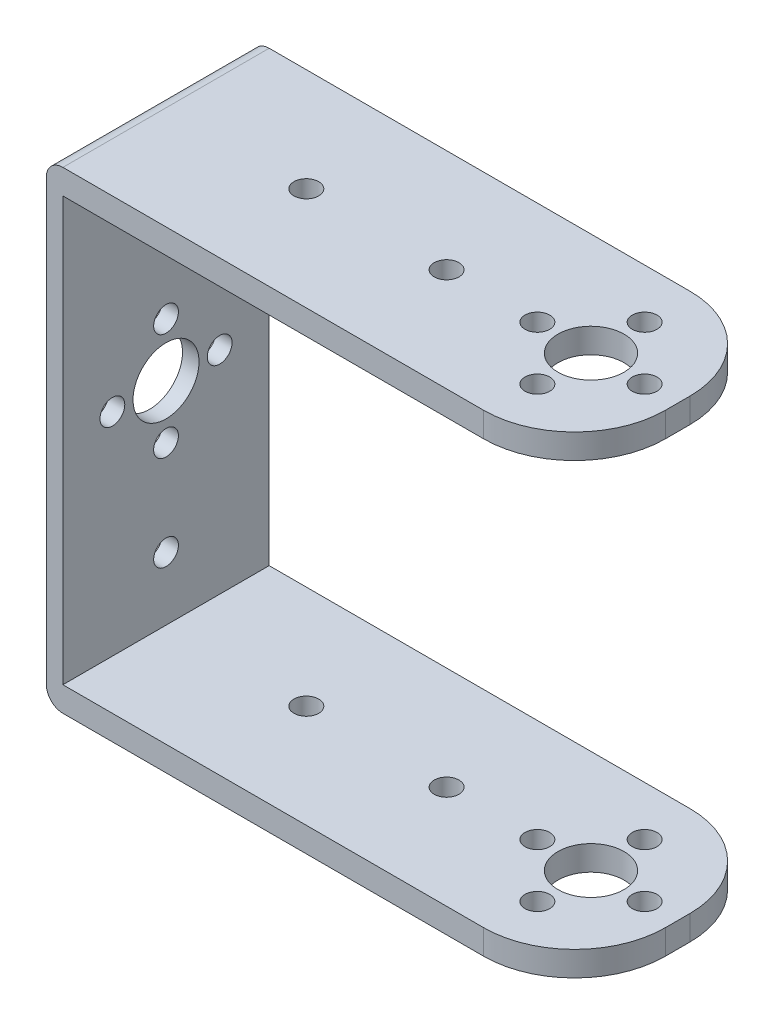
from build123d import *

# Parameters (mm, degrees)
BOSS_EXTRUDE1_DEPTH      = 56.3
BOSS_EXTRUDE1_DEPTH_BACK = 1
SKETCH1_W                = 64
SKETCH1_H                = 25
SKETCH3_W                = 62
SKETCH3_H                = 51.3
CUT_EXTRUDE2_DEPTH       = 89.829555892
SKETCH4_R                = 4
SKETCH4_R_2              = 1.5
CUT_EXTRUDE3_DEPTH       = 56
SKETCH8_R                = 1.5
CUT_EXTRUDE4_DEPTH       = 56
FILLET1_R                = 2
SKETCH9_R                = 1.5
SKETCH9_R_2              = 4
CUT_EXTRUDE5_DEPTH       = 90.466697715
FILLET3_R                = 11
SKETCH10_R               = 1.5
CUT_EXTRUDE6_DEPTH       = 90.466697715


with BuildPart() as part:
    # Sketch1 → Boss-Extrude1 (new, two sides: drawn at the far end of the back side and taken through both)
    with BuildSketch(Plane(origin=(0, 0, 0), x_dir=(1, 0, 0), z_dir=(0, 1, 0)).offset(-BOSS_EXTRUDE1_DEPTH_BACK)):
        with Locations((32, 12.5)):
            Rectangle(SKETCH1_W, SKETCH1_H)
    extrude(amount=BOSS_EXTRUDE1_DEPTH + BOSS_EXTRUDE1_DEPTH_BACK)

    # Sketch3 → Cut-Extrude2 (cut, through all)
    with BuildSketch(Plane.XY):
        with Locations((33, 27.65)):
            Rectangle(SKETCH3_W, SKETCH3_H)
    extrude(amount=-CUT_EXTRUDE2_DEPTH, mode=Mode.SUBTRACT)

    # Sketch4 → Cut-Extrude3 (cut)
    with BuildSketch(Plane(origin=(2, 0, 0), x_dir=(0, 0, -1), z_dir=(1, 0, 0))):
        with Locations(Location((12.5, 27.65, 0), (0, 0, 90))):
            Circle(SKETCH4_R)
        with Locations(Location((19, 27.65, 0), (0, 0, 90))):
            Circle(SKETCH4_R_2)
        with Locations(Location((12.5, 34.15, 0), (0, 0, 90))):
            Circle(SKETCH4_R_2)
        with Locations(Location((6, 27.65, 0), (0, 0, 180))):
            Circle(SKETCH4_R_2)
        with Locations(Location((12.5, 21.15, 0), (0, 0, 180))):
            Circle(SKETCH4_R_2)
    extrude(amount=-CUT_EXTRUDE3_DEPTH, mode=Mode.SUBTRACT)

    # Sketch8 → Cut-Extrude4 (cut)
    with BuildSketch(Plane(origin=(2, 0, 0), x_dir=(0, 0, -1), z_dir=(1, 0, 0))):
        with Locations(Location((12.5, 45.65, 0), (0, 0, 90))):
            Circle(SKETCH8_R)
        with Locations(Location((12.5, 9.65, 0), (0, 0, 90))):
            Circle(SKETCH8_R)
    extrude(amount=-CUT_EXTRUDE4_DEPTH, mode=Mode.SUBTRACT)

    # Fillet1
    fillet1_edges = [part.edges().sort_by_distance(p)[0] for p in [
        (0, 56.3, -12.5),
        (0, -1, -12.5),
    ]]
    fillet(fillet1_edges, radius=FILLET1_R)

    # Sketch9 → Cut-Extrude5 (cut, through all)
    with BuildSketch(Plane(origin=(0, 56.3, 0), x_dir=(1, 0, 0), z_dir=(0, 1, 0))):
        with Locations(Location((60, 12.5, 0), (0, 0, 270))):
            Circle(SKETCH9_R)
        with Locations(Location((53.5, 12.5, 0), (0, 0, 270))):
            Circle(SKETCH9_R_2)
        with Locations(Location((53.5, 19, 0), (0, 0, 270))):
            Circle(SKETCH9_R)
        with Locations(Location((47, 12.5, 0), (0, 0, 270))):
            Circle(SKETCH9_R)
        with Locations(Location((53.5, 6, 0), (0, 0, 270))):
            Circle(SKETCH9_R)
    extrude(amount=-CUT_EXTRUDE5_DEPTH, mode=Mode.SUBTRACT)

    # Fillet3
    fillet3_edges = [part.edges().sort_by_distance(p)[0] for p in [
        (64, 54.8, 0),
        (64, 54.8, -25),
        (64, 0.5, -25),
        (64, 0.5, 0),
    ]]
    fillet(fillet3_edges, radius=FILLET3_R)

    # Sketch10 → Cut-Extrude6 (cut, through all)
    with BuildSketch(Plane(origin=(0, 56.3, 0), x_dir=(1, 0, 0), z_dir=(0, 1, 0))):
        with Locations(Location((36, 12.5, 0), (0, 0, 270))):
            Circle(SKETCH10_R)
        with Locations(Location((19, 12.5, 0), (0, 0, 270))):
            Circle(SKETCH10_R)
    extrude(amount=-CUT_EXTRUDE6_DEPTH, mode=Mode.SUBTRACT)


solid = part.part
